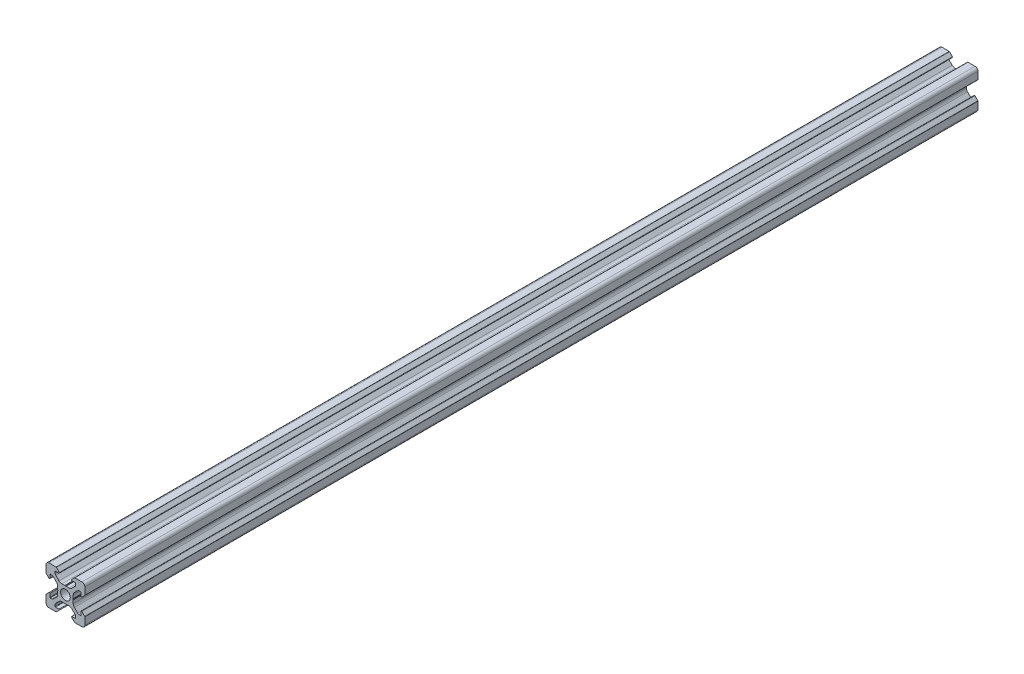
from build123d import *

# Parameters (mm, degrees)
MODEL_R         = 2.5
EXTRUDE_1_DEPTH = 460


with BuildPart() as part:
    # Model → Бобышка-Вытянуть1 (new body)
    with BuildSketch(Plane.XY):
        with BuildLine():
            Line((18.94214915, 33.362214718), (18.94214915, 34.923300122))
            ThreePointArc((18.94214915, 34.923300122), (18.789908215, 35.688666987), (18.356362712, 36.337513684))
            Line((18.356362712, 36.337513684), (16.662250163, 38.031626234))
            ThreePointArc((16.662250163, 38.031626234), (16.337826814, 38.248398985), (15.955143382, 38.324519453))
            Line((15.955143382, 38.324519453), (15.14214915, 38.324519453))
            ThreePointArc((15.14214915, 38.324519453), (15.000727794, 38.265940809), (14.94214915, 38.124519453))
            Line((14.94214915, 38.124519453), (14.94214915, 36.354519453))
            ThreePointArc((14.94214915, 36.354519453), (14.787820008, 36.12354957), (14.515372455, 36.177742757))
            Line((14.515372455, 36.177742757), (13.015372455, 37.677742757))
            ThreePointArc((13.015372455, 37.677742757), (12.961179267, 37.758848595), (12.94214915, 37.854519453))
            Line((12.94214915, 37.854519453), (12.94214915, 41.524519453))
            ThreePointArc((12.94214915, 41.524519453), (13.381488978, 42.585179625), (14.44214915, 43.024519453))
            Line((14.44214915, 43.024519453), (18.11214915, 43.024519453))
            ThreePointArc((18.11214915, 43.024519453), (18.207820008, 43.005489336), (18.288925845, 42.951296148))
            Line((18.288925845, 42.951296148), (19.788925845, 41.451296148))
            ThreePointArc((19.788925845, 41.451296148), (19.843119033, 41.178848595), (19.61214915, 41.024519453))
            Line((19.61214915, 41.024519453), (17.84214915, 41.024519453))
            ThreePointArc((17.84214915, 41.024519453), (17.700727794, 40.965940809), (17.64214915, 40.824519453))
            Line((17.64214915, 40.824519453), (17.64214915, 40.011525221))
            ThreePointArc((17.64214915, 40.011525221), (17.718269617, 39.628841789), (17.935042369, 39.30441844))
            Line((17.935042369, 39.30441844), (19.629154919, 37.61030589))
            ThreePointArc((19.629154919, 37.61030589), (20.278001616, 37.176760388), (21.043368481, 37.024519453))
            Line((21.043368481, 37.024519453), (22.604453885, 37.024519453))
            ThreePointArc((22.604453885, 37.024519453), (22.687205621, 37.010426533), (22.760627647, 36.969736655))
            Line((22.760627647, 36.969736655), (22.94214915, 36.824519453))
            Line((22.94214915, 36.824519453), (23.123670653, 36.969736655))
            ThreePointArc((23.123670653, 36.969736655), (23.197092679, 37.010426533), (23.279844415, 37.024519453))
            Line((23.279844415, 37.024519453), (24.840929819, 37.024519453))
            ThreePointArc((24.840929819, 37.024519453), (25.606296684, 37.176760388), (26.255143382, 37.61030589))
            Line((26.255143382, 37.61030589), (27.949255931, 39.30441844))
            ThreePointArc((27.949255931, 39.30441844), (28.166028683, 39.628841789), (28.24214915, 40.011525221))
            Line((28.24214915, 40.011525221), (28.24214915, 40.824519453))
            ThreePointArc((28.24214915, 40.824519453), (28.183570506, 40.965940809), (28.04214915, 41.024519453))
            Line((28.04214915, 41.024519453), (26.27214915, 41.024519453))
            ThreePointArc((26.27214915, 41.024519453), (26.041179267, 41.178848595), (26.095372455, 41.451296148))
            Line((26.095372455, 41.451296148), (27.595372455, 42.951296148))
            ThreePointArc((27.595372455, 42.951296148), (27.676478292, 43.005489336), (27.77214915, 43.024519453))
            Line((27.77214915, 43.024519453), (31.44214915, 43.024519453))
            ThreePointArc((31.44214915, 43.024519453), (32.502809322, 42.585179625), (32.94214915, 41.524519453))
            Line((32.94214915, 41.524519453), (32.94214915, 37.854519453))
            ThreePointArc((32.94214915, 37.854519453), (32.923119033, 37.758848595), (32.868925845, 37.677742757))
            Line((32.868925845, 37.677742757), (31.368925845, 36.177742757))
            ThreePointArc((31.368925845, 36.177742757), (31.096478292, 36.12354957), (30.94214915, 36.354519453))
            Line((30.94214915, 36.354519453), (30.94214915, 38.124519453))
            ThreePointArc((30.94214915, 38.124519453), (30.883570506, 38.265940809), (30.74214915, 38.324519453))
            Line((30.74214915, 38.324519453), (29.929154919, 38.324519453))
            ThreePointArc((29.929154919, 38.324519453), (29.546471486, 38.248398985), (29.222048137, 38.031626234))
            Line((29.222048137, 38.031626234), (27.527935588, 36.337513684))
            ThreePointArc((27.527935588, 36.337513684), (27.094390085, 35.688666987), (26.94214915, 34.923300122))
            Line((26.94214915, 34.923300122), (26.94214915, 33.362214718))
            ThreePointArc((26.94214915, 33.362214718), (26.92805623, 33.279462982), (26.887366352, 33.206040956))
            Line((26.887366352, 33.206040956), (26.74214915, 33.024519453))
            Line((26.74214915, 33.024519453), (26.887366352, 32.84299795))
            ThreePointArc((26.887366352, 32.84299795), (26.92805623, 32.769575923), (26.94214915, 32.686824188))
            Line((26.94214915, 32.686824188), (26.94214915, 31.125738784))
            ThreePointArc((26.94214915, 31.125738784), (27.094390085, 30.360371919), (27.527935588, 29.711525221))
            Line((27.527935588, 29.711525221), (29.222048137, 28.017412672))
            ThreePointArc((29.222048137, 28.017412672), (29.546471486, 27.80063992), (29.929154919, 27.724519453))
            Line((29.929154919, 27.724519453), (30.74214915, 27.724519453))
            ThreePointArc((30.74214915, 27.724519453), (30.883570506, 27.783098097), (30.94214915, 27.924519453))
            Line((30.94214915, 27.924519453), (30.94214915, 29.694519453))
            ThreePointArc((30.94214915, 29.694519453), (31.096478292, 29.925489336), (31.368925845, 29.871296148))
            Line((31.368925845, 29.871296148), (32.868925845, 28.371296148))
            ThreePointArc((32.868925845, 28.371296148), (32.923119033, 28.290190311), (32.94214915, 28.194519453))
            Line((32.94214915, 28.194519453), (32.94214915, 24.524519453))
            ThreePointArc((32.94214915, 24.524519453), (32.502809322, 23.463859281), (31.44214915, 23.024519453))
            Line((31.44214915, 23.024519453), (27.77214915, 23.024519453))
            ThreePointArc((27.77214915, 23.024519453), (27.676478292, 23.04354957), (27.595372455, 23.097742757))
            Line((27.595372455, 23.097742757), (26.095372455, 24.597742757))
            ThreePointArc((26.095372455, 24.597742757), (26.041179267, 24.870190311), (26.27214915, 25.024519453))
            Line((26.27214915, 25.024519453), (28.04214915, 25.024519453))
            ThreePointArc((28.04214915, 25.024519453), (28.183570506, 25.083098097), (28.24214915, 25.224519453))
            Line((28.24214915, 25.224519453), (28.24214915, 26.037513684))
            ThreePointArc((28.24214915, 26.037513684), (28.166028683, 26.420197117), (27.949255931, 26.744620465))
            Line((27.949255931, 26.744620465), (26.255143382, 28.438733015))
            ThreePointArc((26.255143382, 28.438733015), (25.606296684, 28.872278518), (24.840929819, 29.024519453))
            Line((24.840929819, 29.024519453), (23.279844415, 29.024519453))
            ThreePointArc((23.279844415, 29.024519453), (23.197092679, 29.038612373), (23.123670653, 29.07930225))
            Line((23.123670653, 29.07930225), (22.94214915, 29.224519453))
            Line((22.94214915, 29.224519453), (22.760627647, 29.07930225))
            ThreePointArc((22.760627647, 29.07930225), (22.687205621, 29.038612373), (22.604453885, 29.024519453))
            Line((22.604453885, 29.024519453), (21.043368481, 29.024519453))
            ThreePointArc((21.043368481, 29.024519453), (20.278001616, 28.872278518), (19.629154919, 28.438733015))
            Line((19.629154919, 28.438733015), (17.935042369, 26.744620465))
            ThreePointArc((17.935042369, 26.744620465), (17.718269617, 26.420197117), (17.64214915, 26.037513684))
            Line((17.64214915, 26.037513684), (17.64214915, 25.224519453))
            ThreePointArc((17.64214915, 25.224519453), (17.700727794, 25.083098097), (17.84214915, 25.024519453))
            Line((17.84214915, 25.024519453), (19.61214915, 25.024519453))
            ThreePointArc((19.61214915, 25.024519453), (19.843119033, 24.870190311), (19.788925845, 24.597742757))
            Line((19.788925845, 24.597742757), (18.288925845, 23.097742757))
            ThreePointArc((18.288925845, 23.097742757), (18.207820008, 23.04354957), (18.11214915, 23.024519453))
            Line((18.11214915, 23.024519453), (14.44214915, 23.024519453))
            ThreePointArc((14.44214915, 23.024519453), (13.381488978, 23.463859281), (12.94214915, 24.524519453))
            Line((12.94214915, 24.524519453), (12.94214915, 28.194519453))
            ThreePointArc((12.94214915, 28.194519453), (12.961179267, 28.290190311), (13.015372455, 28.371296148))
            Line((13.015372455, 28.371296148), (14.515372455, 29.871296148))
            ThreePointArc((14.515372455, 29.871296148), (14.787820008, 29.925489336), (14.94214915, 29.694519453))
            Line((14.94214915, 29.694519453), (14.94214915, 27.924519453))
            ThreePointArc((14.94214915, 27.924519453), (15.000727794, 27.783098097), (15.14214915, 27.724519453))
            Line((15.14214915, 27.724519453), (15.955143382, 27.724519453))
            ThreePointArc((15.955143382, 27.724519453), (16.337826814, 27.80063992), (16.662250163, 28.017412672))
            Line((16.662250163, 28.017412672), (18.356362712, 29.711525221))
            ThreePointArc((18.356362712, 29.711525221), (18.789908215, 30.360371919), (18.94214915, 31.125738784))
            Line((18.94214915, 31.125738784), (18.94214915, 32.686824188))
            ThreePointArc((18.94214915, 32.686824188), (18.95624207, 32.769575923), (18.996931948, 32.84299795))
            Line((18.996931948, 32.84299795), (19.14214915, 33.024519453))
            Line((19.14214915, 33.024519453), (18.996931948, 33.206040956))
            ThreePointArc((18.996931948, 33.206040956), (18.95624207, 33.279462982), (18.94214915, 33.362214718))
        make_face()
        with Locations((22.94214915, 33.024519453)):
            Circle(MODEL_R, mode=Mode.SUBTRACT)
    extrude(amount=EXTRUDE_1_DEPTH)


solid = part.part
